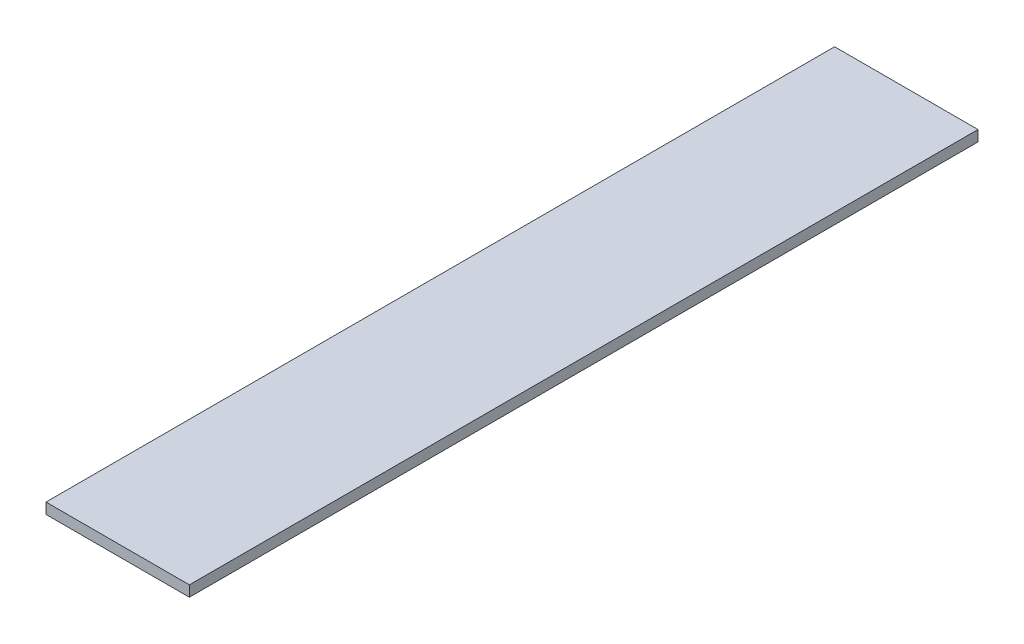
from build123d import *

# Parameters (mm, degrees)
PACK_ORTA_RAY_YARIKLI_1_START = -570
SKETCH1_W                     = 40
SKETCH1_H                     = 3
PACK_ORTA_RAY_YARIKLI_1_DEPTH = 220


with BuildPart() as part:
    # Sketch1 → PACK_orta_ray_yarikli_1 (new body)
    with BuildSketch(Plane.XY.offset(PACK_ORTA_RAY_YARIKLI_1_START)):
        with Locations((350, 598.5)):
            Rectangle(SKETCH1_W, SKETCH1_H)
    extrude(amount=-PACK_ORTA_RAY_YARIKLI_1_DEPTH)


solid = part.part
